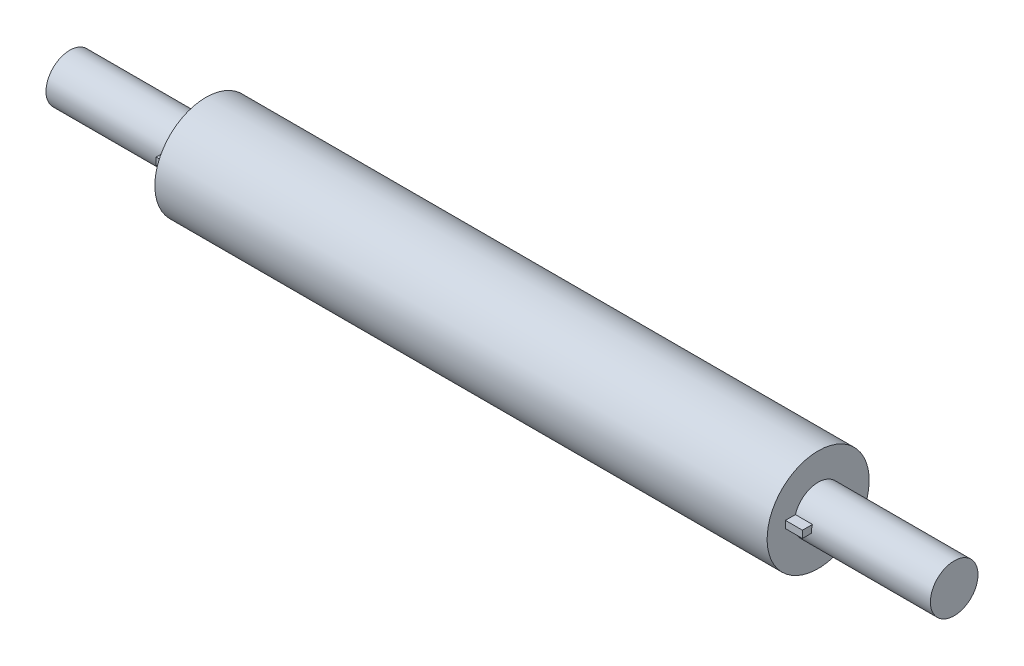
from build123d import *

# Parameters (mm, degrees)
BOSS_EXTRUDE1_START = 5
BOSS_EXTRUDE1_DEPTH = 5


with BuildPart() as part:
    # Sketch2 → Revolve1 (revolve)
    with BuildSketch(Plane.XY):
        Polygon((130, 0), (-130, 0), (-130, -7), (-90, -7), (-90, -15), (90, -15), (90, -7), (130, -7), align=None)
    revolve(axis=Axis((130, 0, 0), (-1, 0, 0)))

    # Sketch3 → Boss-Extrude1 (add)
    with BuildSketch(Plane(origin=(90, 0, 0), x_dir=(0, 0, -1), z_dir=(1, 0, 0)).offset(BOSS_EXTRUDE1_START)):
        with BuildLine():
            Line((-7, 0), (-9.611930855, 0))
            Line((-9.611930855, 0), (-9.611930855, 2.103316634))
            Line((-9.611930855, 2.103316634), (-6.676530471, 2.103316634))
            ThreePointArc((-6.676530471, 2.103316634), (-6.918660033, 1.064022251), (-7, 0))
        make_face()
    boss_extrude1 = extrude(amount=-BOSS_EXTRUDE1_DEPTH)

    # Mirror1: Boss-Extrude1 across plane
    add(boss_extrude1.mirror(Plane(origin=(0, 0, 0), x_dir=(0, 0, 1), z_dir=(1, 0, 0))))


solid = part.part
